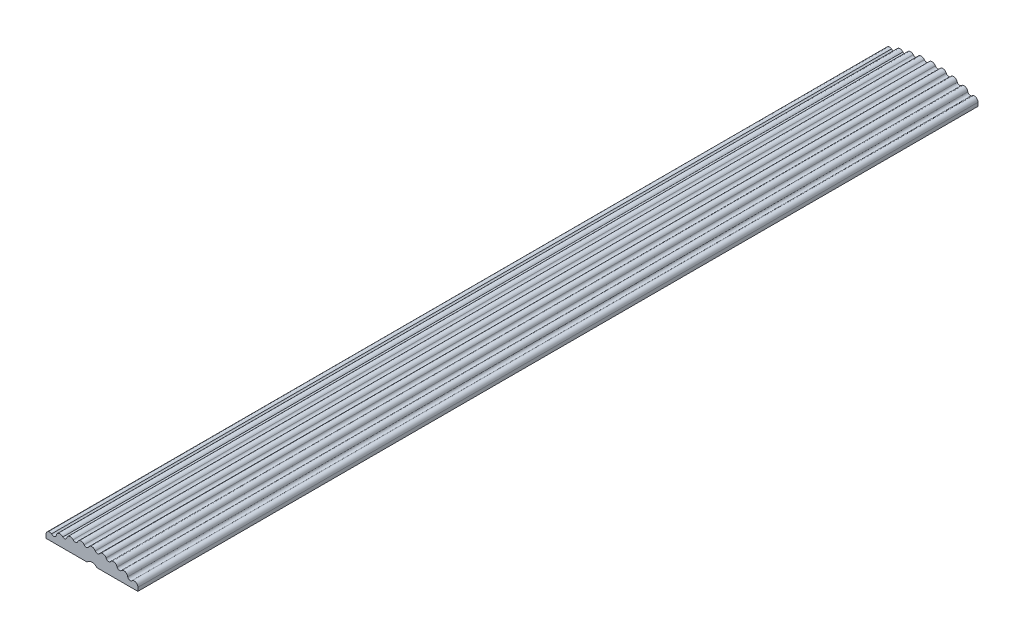
from build123d import *

# Parameters (mm, degrees)
BOSS_EXTRUDE2_DEPTH = 203.2
CUT_EXTRUDE1_REACH  = 357.917
SKETCH2_W           = 22.225
SKETCH2_H           = 25.4


with BuildPart() as part:
    # Sketch1 → Boss-Extrude2 (new body)
    with BuildSketch(Plane.XY.offset(152.4)):
        with BuildLine():
            Line((-11.1125, 7.155754294), (-11.1125, 6.2992))
            Line((-11.1125, 6.2992), (-4.0132, 6.2992))
            ThreePointArc((-4.0132, 6.2992), (-3.653989755, 6.150410245), (-3.5052, 5.7912))
            Line((-3.5052, 5.7912), (-3.5052, 3.980754294))
            ThreePointArc((-3.5052, 3.980754294), (-3.653989755, 3.621544049), (-4.0132, 3.472754294))
            Line((-4.0132, 3.472754294), (-4.7625, 3.472754294))
            Line((-4.7625, 3.472754294), (-2.563540889, 1.114659348))
            ThreePointArc((-2.563540889, 1.114659348), (1.91e-07, 0), (2.563541217, 1.114659472))
            Line((2.563541217, 1.114659472), (4.7625, 3.472754294))
            Line((4.7625, 3.472754294), (4.0132, 3.472754294))
            ThreePointArc((4.0132, 3.472754294), (3.653989755, 3.621544049), (3.5052, 3.980754294))
            Line((3.5052, 3.980754294), (3.5052, 5.7912))
            ThreePointArc((3.5052, 5.7912), (3.653989755, 6.150410245), (4.0132, 6.2992))
            Line((4.0132, 6.2992), (11.1125, 6.2992))
            Line((11.1125, 6.2992), (11.1125, 7.155754292))
            ThreePointArc((11.1125, 7.155754292), (10.663537153, 7.928210313), (9.770119113, 7.920454737))
            ThreePointArc((9.770119113, 7.920454737), (9.148763616, 7.659085907), (8.642363834, 8.104007899))
            ThreePointArc((8.642363834, 8.104007899), (8.019118897, 8.901877), (7.05308944, 8.59886472))
            ThreePointArc((7.05308944, 8.59886472), (6.504535766, 8.494192995), (6.085440415, 8.863281588))
            ThreePointArc((6.085440415, 8.863281588), (5.452899276, 9.555232733), (4.552056662, 9.295642159))
            ThreePointArc((4.552056662, 9.295642159), (3.931317659, 9.028192281), (3.421209266, 9.471628606))
            ThreePointArc((3.421209266, 9.471628606), (2.68084511, 9.976690828), (1.876956272, 9.580471612))
            ThreePointArc((1.876956272, 9.580471612), (1.327001325, 9.29621405), (0.796430567, 9.615192851))
            ThreePointArc((0.796430567, 9.615192851), (-2e-09, 10.1092), (-0.796430568, 9.615192848))
            ThreePointArc((-0.796430568, 9.615192848), (-1.327001326, 9.29621405), (-1.876956272, 9.580471612))
            ThreePointArc((-1.876956272, 9.580471612), (-2.680845114, 9.976690828), (-3.421209269, 9.471628598))
            ThreePointArc((-3.421209269, 9.471628598), (-3.931317662, 9.028192282), (-4.552056659, 9.295642158))
            ThreePointArc((-4.552056659, 9.295642158), (-5.45289928, 9.555232733), (-6.085440418, 8.863281574))
            ThreePointArc((-6.085440418, 8.863281574), (-6.504535766, 8.494192992), (-7.053089431, 8.59886471))
            ThreePointArc((-7.053089431, 8.59886471), (-8.019118881, 8.901877006), (-8.642363831, 8.104007918))
            ThreePointArc((-8.642363831, 8.104007918), (-9.148763609, 7.659085911), (-9.770119113, 7.920454739))
            ThreePointArc((-9.770119113, 7.920454739), (-10.663537153, 7.928210315), (-11.1125, 7.155754294))
        make_face()
        with BuildLine():
            Line((-1.5875, 3.472754294), (-1.5875, 5.276154294))
            ThreePointArc((-1.5875, 5.276154294), (0, 6.863654294), (1.5875, 5.276154294))
            Line((1.5875, 5.276154294), (1.5875, 3.472754294))
            ThreePointArc((1.5875, 3.472754294), (0, 1.885254294), (-1.5875, 3.472754294))
        make_face(mode=Mode.SUBTRACT)
    extrude(amount=BOSS_EXTRUDE2_DEPTH)

    # Cut-Extrude1: up to this face of the body (flat: up to its plane)
    cut_extrude1_end = Plane(part.part.faces().sort_by_distance((7.56285, 6.2992, 254))[0])
    # Sketch2 → Cut-Extrude1 (cut, up to the picked face)
    with BuildSketch(Plane(origin=(0, 0, 0), x_dir=(1, 0, 0), z_dir=(0, 1, 0)), mode=Mode.PRIVATE) as cut_extrude1_sk1:
        with Locations((0, -165.1)):
            Rectangle(SKETCH2_W, SKETCH2_H)
    cut_extrude1_tool1 = split(extrude(cut_extrude1_sk1.sketch, amount=CUT_EXTRUDE1_REACH, mode=Mode.PRIVATE), bisect_by=cut_extrude1_end, keep=Keep.BOTH, mode=Mode.PRIVATE)
    # Sketch2 → Cut-Extrude1 (cut, up to the picked face)
    with BuildSketch(Plane(origin=(0, 0, 0), x_dir=(1, 0, 0), z_dir=(0, 1, 0)), mode=Mode.PRIVATE) as cut_extrude1_sk2:
        with Locations((0, -342.9)):
            Rectangle(SKETCH2_W, SKETCH2_H)
    cut_extrude1_tool2 = split(extrude(cut_extrude1_sk2.sketch, amount=CUT_EXTRUDE1_REACH, mode=Mode.PRIVATE), bisect_by=cut_extrude1_end, keep=Keep.BOTH, mode=Mode.PRIVATE)
    add(cut_extrude1_tool1.solids().sort_by(Axis((0, 0, 165.1), (0, 1, 0)))[0], mode=Mode.SUBTRACT)
    add(cut_extrude1_tool2.solids().sort_by(Axis((0, 0, 342.9), (0, 1, 0)))[0], mode=Mode.SUBTRACT)


solid = part.part
